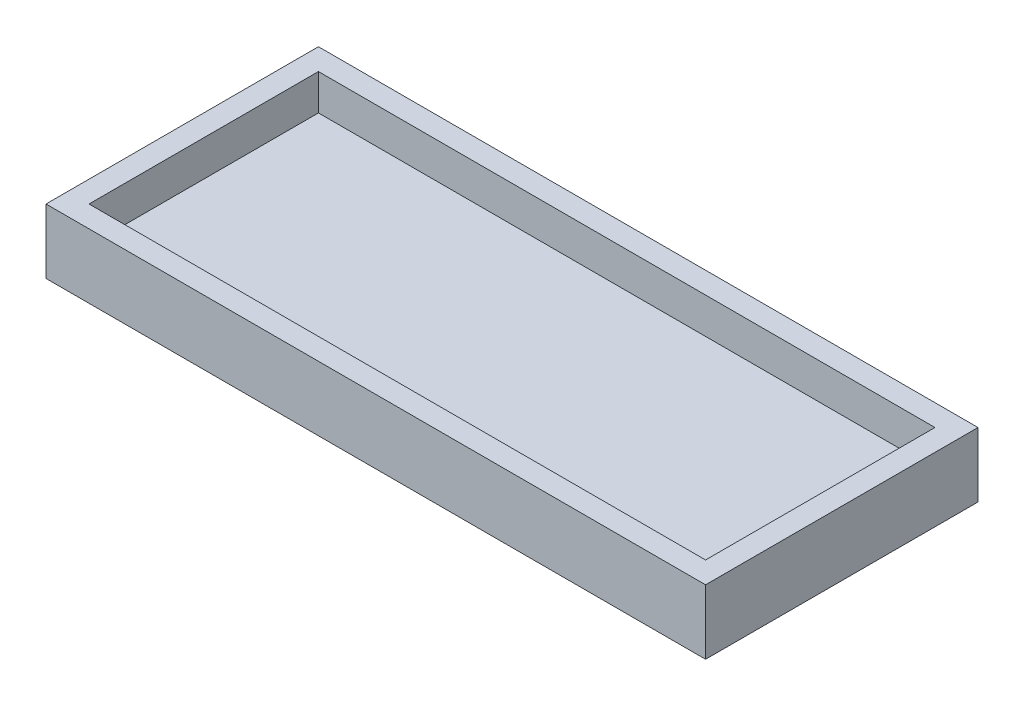
from build123d import *

# Parameters (mm, degrees)
SKETCH1_W           = 43
SKETCH1_H           = 16
BOSS_EXTRUDE1_DEPTH = 2
SKETCH2_W           = 46
SKETCH2_H           = 19
SKETCH2_W_2         = 43
SKETCH2_H_2         = 16
BOSS_EXTRUDE4_DEPTH = 4.5


with BuildPart() as part:
    # Sketch1 → Boss-Extrude1 (new body)
    with BuildSketch(Plane(origin=(0, 0, 0), x_dir=(1, 0, 0), z_dir=(0, 1, 0))):
        Rectangle(SKETCH1_W, SKETCH1_H)
    extrude(amount=BOSS_EXTRUDE1_DEPTH)

    # Sketch2 → Boss-Extrude4 (add)
    with BuildSketch(Plane.XZ):
        Rectangle(SKETCH2_W, SKETCH2_H)
        Rectangle(SKETCH2_W_2, SKETCH2_H_2, mode=Mode.SUBTRACT)
    extrude(amount=-BOSS_EXTRUDE4_DEPTH)


solid = part.part
